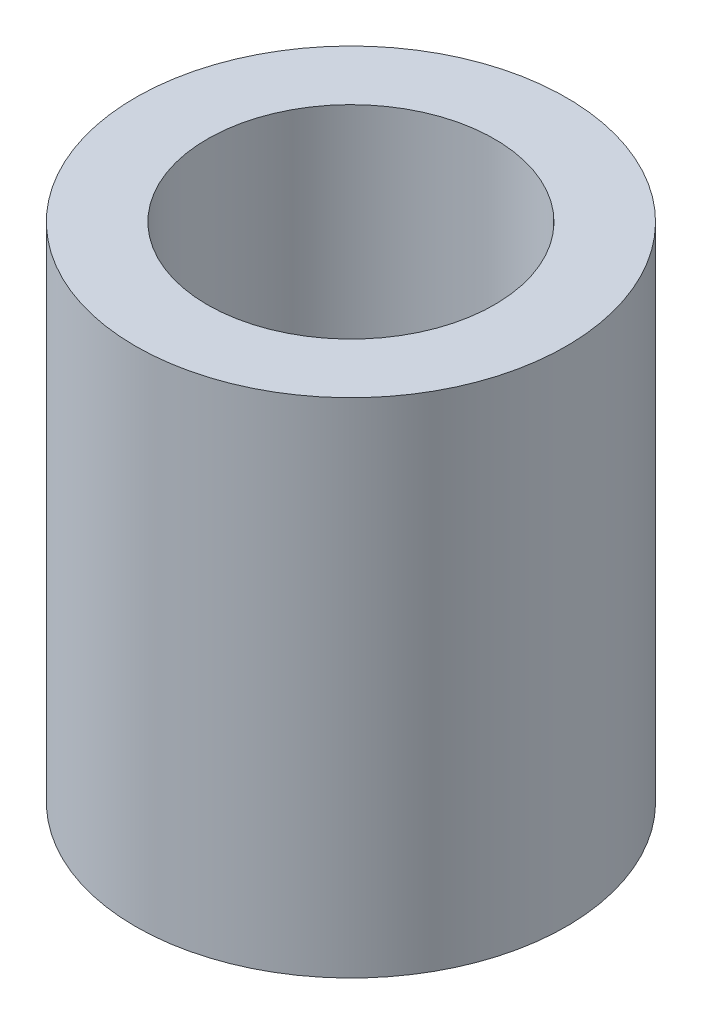
from build123d import *

# Parameters (mm, degrees)
SKETCH2_R           = 3
SKETCH2_R_2         = 2
BOSS_EXTRUDE1_DEPTH = 7


with BuildPart() as part:
    # Sketch2 → Boss-Extrude1 (new body)
    with BuildSketch(Plane(origin=(0, 0, 0), x_dir=(1, 0, 0), z_dir=(0, 1, 0))):
        with Locations(Location((0, 0, 0), (0, 0, 270))):
            Circle(SKETCH2_R)
        with Locations(Location((0, 0, 0), (0, 0, 270))):
            Circle(SKETCH2_R_2, mode=Mode.SUBTRACT)
    extrude(amount=BOSS_EXTRUDE1_DEPTH)


solid = part.part
